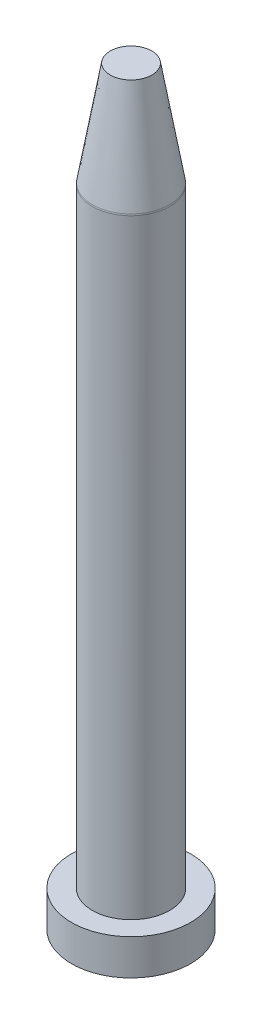
from build123d import *

# Parameters (mm, degrees)
FILLET_1_R = 3


with BuildPart() as part:
    # 草图1 → Revolve 292 (revolve)
    with BuildSketch(Plane.XY, mode=Mode.PRIVATE) as revolve_292_sk:
        Polygon((0, 0), (20, 0), (20, 12), (13, 12), (13, 217), (7, 252), (0, 252), align=None)
    revolve(revolve_292_sk.sketch.rotate(Axis((0, 0, 0), (0, 1, 0)), 90), axis=Axis((0, 0, 0), (0, 1, 0)))

    # 圆角1
    fillet_1_edges = [part.edges().sort_by_distance(p)[0] for p in [
        (0, 217, 13),
    ]]
    fillet(fillet_1_edges, radius=FILLET_1_R)


solid = part.part
